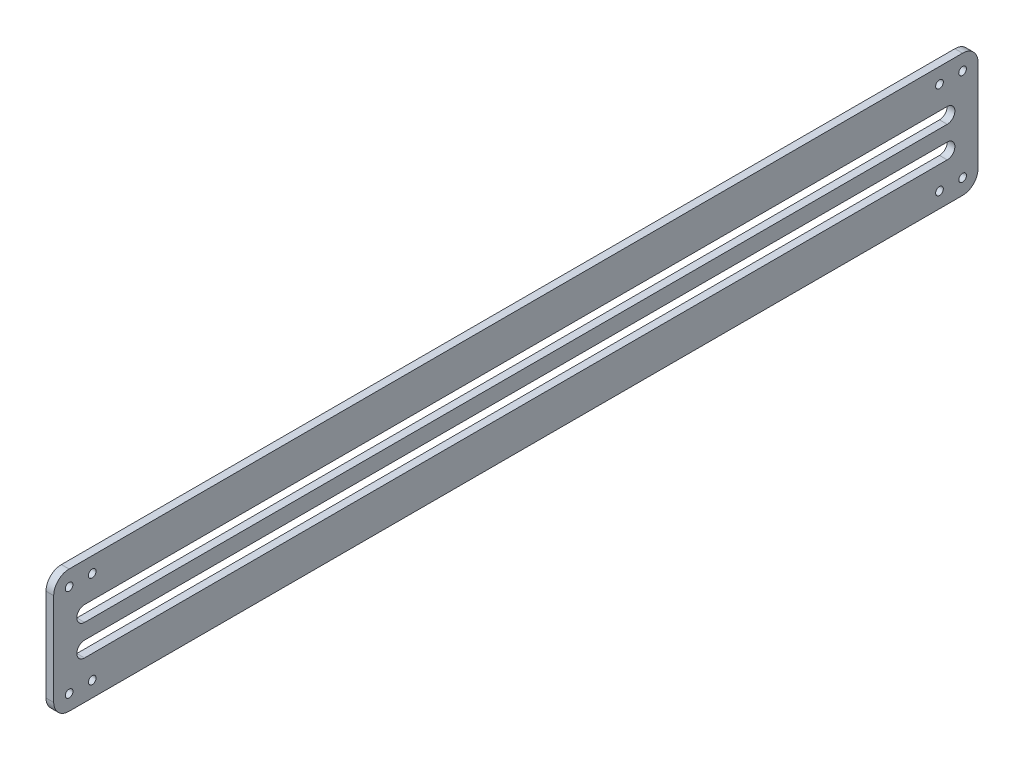
from build123d import *

# Parameters (mm, degrees)
OUTER_CUT_DEPTH   = 1.5875
SLOTS_DEPTH       = 193.212098019
SKETCH3_R         = 1.5875
MOUNT_HOLES_DEPTH = 193.212098019


with BuildPart() as part:
    # Sketch1 → Outer Cut (new, symmetric)
    with BuildSketch(Plane(origin=(0, 0, 0), x_dir=(0, 0, -1), z_dir=(1, 0, 0))):
        with BuildLine():
            Line((-184.15, -25.4), (184.15, -25.4))
            ThreePointArc((184.15, -25.4), (188.640128061, -23.540128061), (190.5, -19.05))
            Line((190.5, -19.05), (190.5, 19.05))
            ThreePointArc((190.5, 19.05), (188.640128061, 23.540128061), (184.15, 25.4))
            Line((184.15, 25.4), (-184.15, 25.4))
            ThreePointArc((-184.15, 25.4), (-188.640128061, 23.540128061), (-190.5, 19.05))
            Line((-190.5, 19.05), (-190.5, -19.05))
            ThreePointArc((-190.5, -19.05), (-188.640128061, -23.540128061), (-184.15, -25.4))
        make_face()
    extrude(amount=OUTER_CUT_DEPTH, both=True)

    # Sketch2 → Slots (cut, through all)
    with BuildSketch(Plane(origin=(1.5875, 0, 0), x_dir=(0, 0, -1), z_dir=(1, 0, 0))):
        with BuildLine():
            Line((-177.8, 9.525), (177.8, 9.525))
            ThreePointArc((177.8, 9.525), (180.975, 6.35), (177.8, 3.175))
            Line((177.8, 3.175), (-177.8, 3.175))
            ThreePointArc((-177.8, 3.175), (-180.975, 6.35), (-177.8, 9.525))
        make_face()
        with BuildLine():
            Line((-177.8, -9.525), (177.8, -9.525))
            ThreePointArc((177.8, -9.525), (180.975, -6.35), (177.8, -3.175))
            Line((177.8, -3.175), (-177.8, -3.175))
            ThreePointArc((-177.8, -3.175), (-180.975, -6.35), (-177.8, -9.525))
        make_face()
    extrude(amount=-SLOTS_DEPTH, mode=Mode.SUBTRACT)

    # Sketch3 → Mount Holes (cut, through all)
    with BuildSketch(Plane(origin=(1.5875, 0, 0), x_dir=(0, 0, -1), z_dir=(1, 0, 0))):
        with Locations((-184.15, 19.05)):
            Circle(SKETCH3_R)
        with Locations((-174.625, 19.05)):
            Circle(SKETCH3_R)
        with Locations(Location((-174.625, -19.05, 0), (0, 0, 180))):
            Circle(SKETCH3_R)
        with Locations(Location((-184.15, -19.05, 0), (0, 0, 180))):
            Circle(SKETCH3_R)
        with Locations(Location((174.625, 19.05, 0), (0, 0, 180))):
            Circle(SKETCH3_R)
        with Locations(Location((184.15, 19.05, 0), (0, 0, 180))):
            Circle(SKETCH3_R)
        with Locations((184.15, -19.05)):
            Circle(SKETCH3_R)
        with Locations((174.625, -19.05)):
            Circle(SKETCH3_R)
    extrude(amount=-MOUNT_HOLES_DEPTH, mode=Mode.SUBTRACT)


solid = part.part
